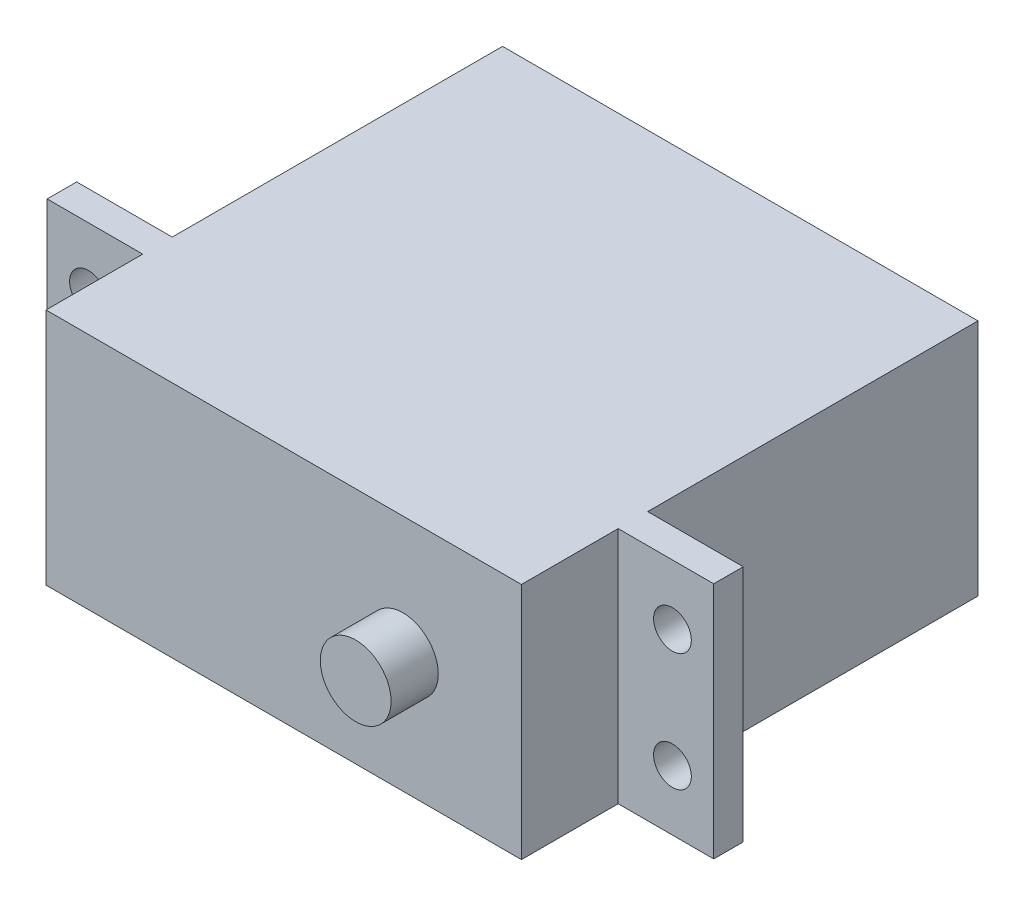
from build123d import *

# Parameters (mm, degrees)
CASE_SKETCH_W      = 40.3
CASE_SKETCH_H      = 20.2
CASE_2_DEPTH       = 38.7
TABS_SKETCH_W      = 56.5
TABS_SKETCH_H      = 20.2
TABS_DEPTH         = 2.5
SHAFT_SKETCH_R     = 3
SHAFT_DEPTH        = 4
TAB_HOLES_SKETCH_R = 1.6
TAB_HOLES_DEPTH    = 2.5


with BuildPart() as part:
    # Case Sketch → Case 2 (new body)
    with BuildSketch(Plane.XY.offset(-26)):
        with Locations((-101.1, 83.4)):
            Rectangle(CASE_SKETCH_W, CASE_SKETCH_H)
    extrude(amount=CASE_2_DEPTH)

    # Tabs Sketch → Tabs (add)
    with BuildSketch(Plane.XY.offset(2)):
        with Locations((-101.1, 83.4)):
            Rectangle(TABS_SKETCH_W, TABS_SKETCH_H)
    extrude(amount=TABS_DEPTH)

    # Shaft Sketch → Shaft (add)
    with BuildSketch(Plane.XY.offset(12.7)):
        with Locations((-91, 83.4)):
            Circle(SHAFT_SKETCH_R)
    extrude(amount=SHAFT_DEPTH)

    # Tab Holes Sketch → Tab Holes (cut)
    with BuildSketch(Plane.XY.offset(2)):
        with Locations((-125.85, 78.4)):
            Circle(TAB_HOLES_SKETCH_R)
        with Locations((-125.85, 88.4)):
            Circle(TAB_HOLES_SKETCH_R)
        with Locations((-76.35, 78.4)):
            Circle(TAB_HOLES_SKETCH_R)
        with Locations((-76.35, 88.4)):
            Circle(TAB_HOLES_SKETCH_R)
    extrude(amount=TAB_HOLES_DEPTH, mode=Mode.SUBTRACT)


solid = part.part
